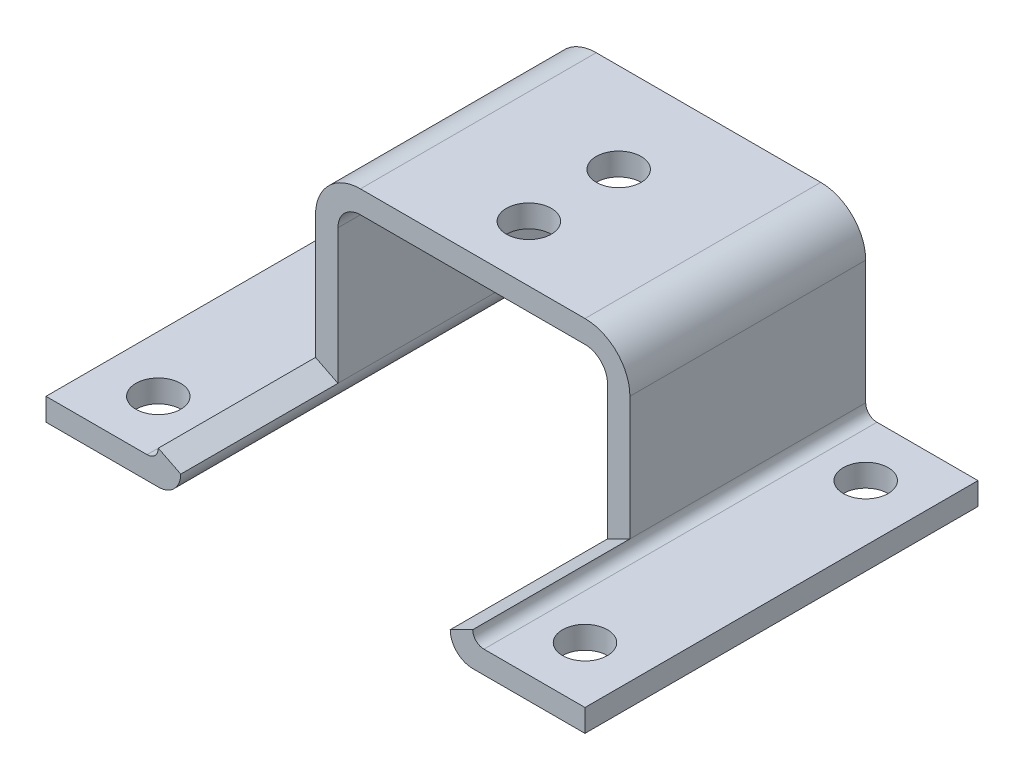
from build123d import *

# Parameters (mm, degrees)
BOSS_EXTRUDE1_DEPTH = 21
BOSS_EXTRUDE2_DEPTH = 14
SKETCH6_R           = 2
CUT_EXTRUDE6_DEPTH  = 5
SKETCH7_R           = 2
CUT_EXTRUDE7_DEPTH  = 5


with BuildPart() as part:
    # Sketch2 → Boss-Extrude1 (new body)
    with BuildSketch(Plane.XY):
        with BuildLine():
            Line((-24, 0), (-14, 0))
            ThreePointArc((-14, 0), (-12.585786438, 0.585786438), (-12, 2))
            Line((-12, 2), (-12, 14))
            ThreePointArc((-12, 14), (-11.414213562, 15.414213562), (-10, 16))
            Line((-10, 16), (0, 16))
            Line((0, 16), (10, 16))
            ThreePointArc((10, 16), (11.414213562, 15.414213562), (12, 14))
            Line((12, 14), (12, 2))
            ThreePointArc((12, 2), (12.585786438, 0.585786438), (14, 0))
            Line((14, 0), (24, 0))
            Line((24, 0), (24, 2))
            Line((24, 2), (15, 2))
            ThreePointArc((15, 2), (14.292893219, 2.292893219), (14, 3))
            Line((14, 3), (14, 14))
            ThreePointArc((14, 14), (12.828427125, 16.828427125), (10, 18))
            Line((10, 18), (0, 18))
            Line((0, 18), (-10, 18))
            ThreePointArc((-10, 18), (-12.828427125, 16.828427125), (-14, 14))
            Line((-14, 14), (-14, 3))
            ThreePointArc((-14, 3), (-14.292893219, 2.292893219), (-15, 2))
            Line((-15, 2), (-24, 2))
            Line((-24, 2), (-24, 0))
        make_face()
    extrude(amount=BOSS_EXTRUDE1_DEPTH)

    # Sketch3 → Boss-Extrude2 (add)
    with BuildSketch(Plane.XY.offset(21)):
        with BuildLine():
            Line((-14, 3), (-12, 2))
            ThreePointArc((-12, 2), (-12.585786438, 0.585786438), (-14, 0))
            Line((-14, 0), (-24, 0))
            Line((-24, 0), (-24, 2))
            Line((-24, 2), (-15, 2))
            ThreePointArc((-15, 2), (-14.292893219, 2.292893219), (-14, 3))
        make_face()
        with BuildLine():
            Line((12, 2), (14, 3))
            ThreePointArc((14, 3), (14.292893219, 2.292893219), (15, 2))
            Line((15, 2), (24, 2))
            Line((24, 2), (24, 0))
            Line((24, 0), (14, 0))
            ThreePointArc((14, 0), (12.585786438, 0.585786438), (12, 2))
        make_face()
    extrude(amount=BOSS_EXTRUDE2_DEPTH)

    # Sketch6 → Cut-Extrude6 (cut)
    with BuildSketch(Plane(origin=(0, 0, 0), x_dir=(1, 0, 0), z_dir=(0, 1, 0))):
        with Locations(Location((-19, -5, 0), (0, 0, 90))):
            Circle(SKETCH6_R)
        with Locations(Location((-19, -30, 0), (0, 0, 90))):
            Circle(SKETCH6_R)
        with Locations(Location((19, -30, 0), (0, 0, 90))):
            Circle(SKETCH6_R)
        with Locations(Location((19, -5, 0), (0, 0, 90))):
            Circle(SKETCH6_R)
    extrude(amount=CUT_EXTRUDE6_DEPTH, mode=Mode.SUBTRACT)

    # Sketch7 → Cut-Extrude7 (cut)
    with BuildSketch(Plane(origin=(0, 18, 0), x_dir=(1, 0, 0), z_dir=(0, 1, 0))):
        with Locations(Location((0, -8, 0), (0, 0, 270))):
            Circle(SKETCH7_R)
        with Locations(Location((0, -16, 0), (0, 0, 270))):
            Circle(SKETCH7_R)
    extrude(amount=-CUT_EXTRUDE7_DEPTH, mode=Mode.SUBTRACT)


solid = part.part
